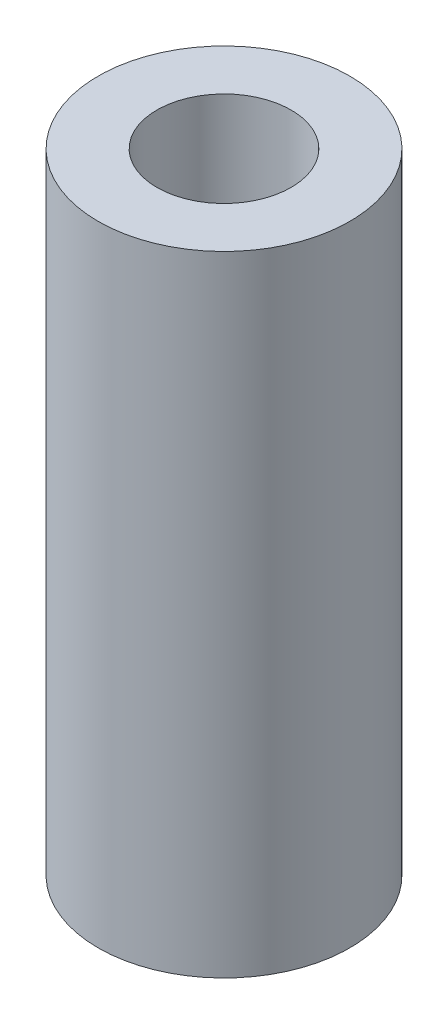
from build123d import *

# Parameters (mm, degrees)
SKETCH_1_R      = 3
SKETCH_1_R_2    = 1.6
EXTRUDE_1_DEPTH = 15


with BuildPart() as part:
    # 草圖1 → 填料-伸長1 (new body)
    with BuildSketch(Plane(origin=(0, 0, 0), x_dir=(1, 0, 0), z_dir=(0, 1, 0))):
        with Locations(Location((0, 0, 0), (0, 0, 270))):
            Circle(SKETCH_1_R)
        with Locations(Location((0, 0, 0), (0, 0, 270))):
            Circle(SKETCH_1_R_2, mode=Mode.SUBTRACT)
    extrude(amount=EXTRUDE_1_DEPTH)


solid = part.part
